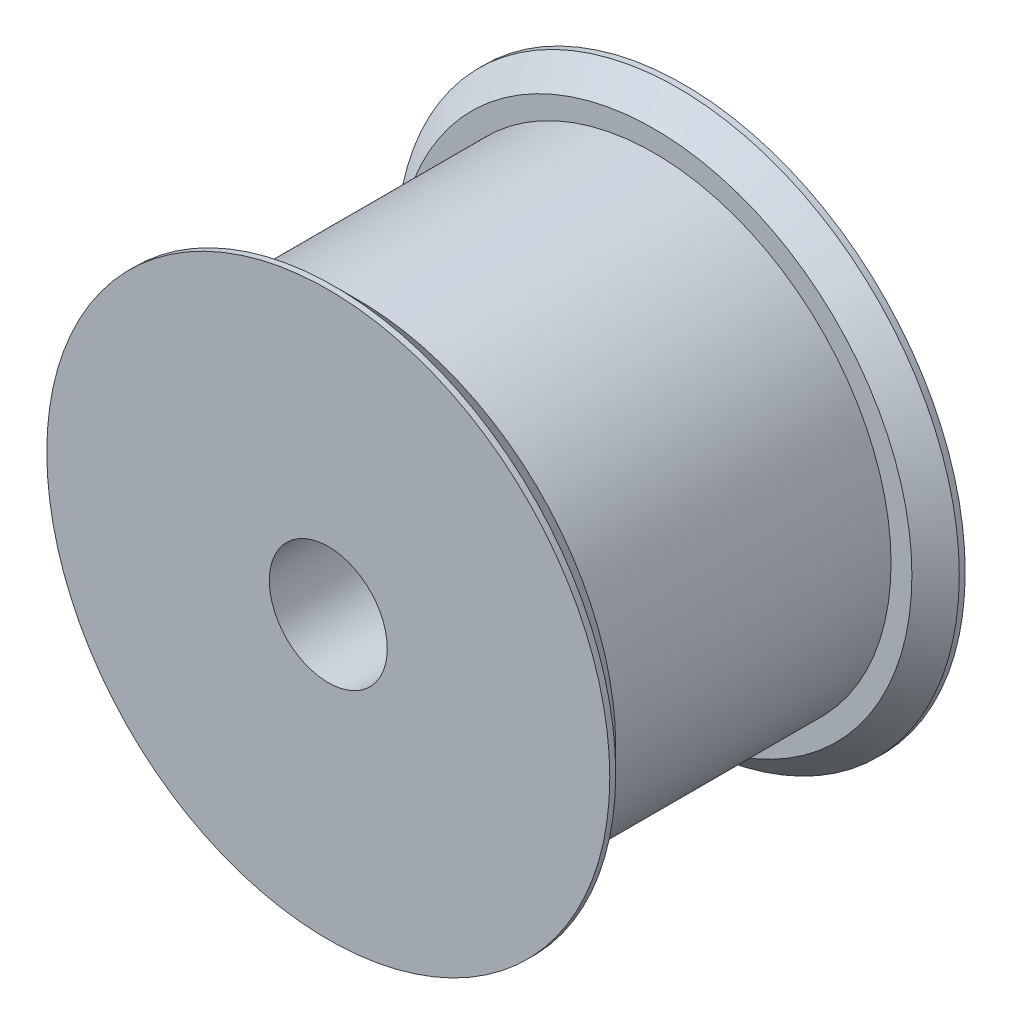
from build123d import *

# Parameters (mm, degrees)
CROQUIS1_R                 = 20
SALIENTE_EXTRUIR1_DEPTH    = 12.5
CROQUIS2_R                 = 23.760562535
SALIENTE_EXTRUIR2_DEPTH    = 2.5
CHAFL_N1_SIZE              = 2
CHAFL_N1_OF_SIMETR_A1_SIZE = 2
CROQUIS3_R                 = 4.978571234
CORTAR_EXTRUIR1_DEPTH      = 46.045850685


with BuildPart() as part:
    # Croquis1 → Saliente-Extruir1 (new, symmetric)
    with BuildSketch(Plane.XY):
        Circle(CROQUIS1_R)
    extrude(amount=SALIENTE_EXTRUIR1_DEPTH, both=True)

    # Croquis2 → Saliente-Extruir2 (add)
    with BuildSketch(Plane.XY.offset(12.5)):
        Circle(CROQUIS2_R)
    saliente_extruir2 = extrude(amount=SALIENTE_EXTRUIR2_DEPTH)

    # Chaflán1
    chafl_n1_edges = [part.edges().sort_by_distance(p)[0] for p in [
        (-23.760562535, 0, 12.5),
    ]]
    chamfer(chafl_n1_edges, length=CHAFL_N1_SIZE)

    # Simetría1: Saliente-Extruir2 across plane
    add(saliente_extruir2.mirror(Plane.XY))

    # Chaflán1 of Simetría1
    chafl_n1_of_simetr_a1_edges = [part.edges().sort_by_distance(p)[0] for p in [
        (-23.760562535, 0, -12.5),
    ]]
    chamfer(chafl_n1_of_simetr_a1_edges, length=CHAFL_N1_OF_SIMETR_A1_SIZE)

    # Croquis3 → Cortar-Extruir1 (cut, through all)
    with BuildSketch(Plane.XY.offset(15)):
        Circle(CROQUIS3_R)
    extrude(amount=-CORTAR_EXTRUIR1_DEPTH, mode=Mode.SUBTRACT)


solid = part.part
